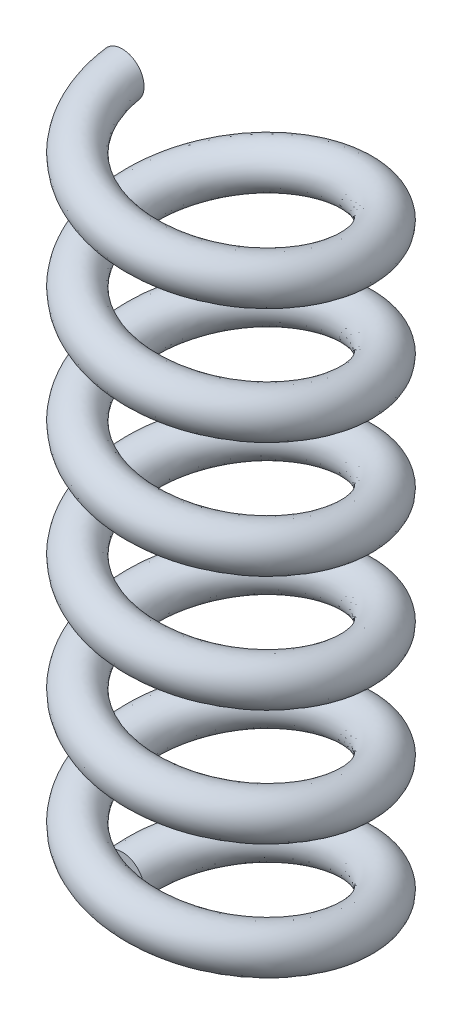
from build123d import *

# Parameters (mm, degrees)
SWEEP1_PITCH       = 3.333333333
SWEEP1_HEIGHT      = 20
SWEEP1_RADIUS      = 3.125
SWEEP1_START_ANGLE = -90
SKETCH2_R          = 0.625


with BuildPart() as part:
    # Sweep1: sweep along a helix
    with BuildLine() as sweep1_path:
        add(Helix(SWEEP1_PITCH, SWEEP1_HEIGHT, SWEEP1_RADIUS, center=(0, 0, 0), direction=(0, 1, 0), lefthand=True, mode=Mode.PRIVATE).rotate(Axis((0, 0, 0), (0, 1, 0)), SWEEP1_START_ANGLE))
    # Sketch2 → Sweep1 (sweep)
    with BuildSketch(Plane.XY):
        with Locations((-3.125, 0)):
            Circle(SKETCH2_R)
    sweep(path=sweep1_path.line, is_frenet=True)


solid = part.part
